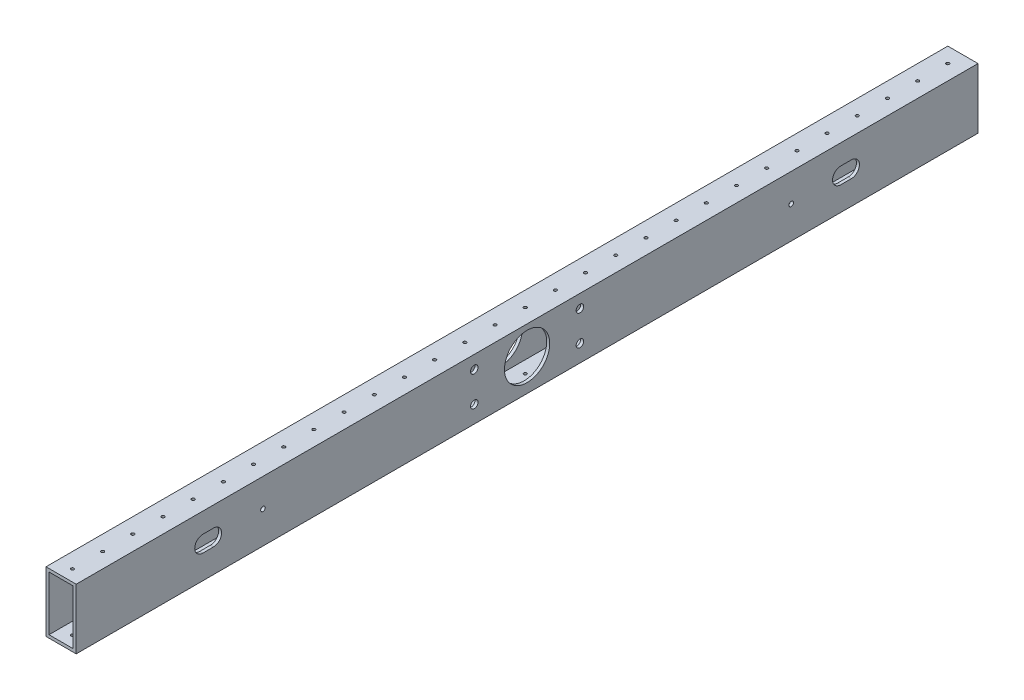
from build123d import *

# Parameters (mm, degrees)
SKETCH1_W           = 25.4
SKETCH1_H           = 50.8
SKETCH1_W_2         = 20.32
SKETCH1_H_2         = 45.72
EXTRUDE_THIN1_DEPTH = 379.4125
SKETCH2_R           = 1.27
CUT_EXTRUDE1_DEPTH  = 384.008844749
LPATTERN1_COUNT     = 30
LPATTERN1_PITCH     = 25.4
SKETCH4_R           = 19.05
SKETCH4_R_2         = 1.9304
CUT_EXTRUDE2_DEPTH  = 382.109124997
SKETCH5_R           = 3.175
CUT_EXTRUDE3_DEPTH  = 382.109124997


with BuildPart() as part:
    # Sketch1 → Extrude-Thin1 (new, symmetric)
    with BuildSketch(Plane.XY):
        Rectangle(SKETCH1_W, SKETCH1_H)
        Rectangle(SKETCH1_W_2, SKETCH1_H_2, mode=Mode.SUBTRACT)
    extrude(amount=EXTRUDE_THIN1_DEPTH, both=True)

    # Sketch2 → Cut-Extrude1 (cut, through all)
    with BuildSketch(Plane(origin=(0, 25.4, 0), x_dir=(1, 0, 0), z_dir=(0, 1, 0))):
        with Locations(Location((0, 366.7125, 0), (0, 0, 270))):
            Circle(SKETCH2_R)
    cut_extrude1 = extrude(amount=-CUT_EXTRUDE1_DEPTH, mode=Mode.SUBTRACT)

    # LPattern1: Cut-Extrude1 ×30
    with Locations(*[(0, 0, i * LPATTERN1_PITCH) for i in range(1, LPATTERN1_COUNT)]):
        add(cut_extrude1, mode=Mode.SUBTRACT)

    # Sketch4 → Cut-Extrude2 (cut, through all)
    with BuildSketch(Plane.ZY.offset(12.7)):
        with Locations((0, 1.651)):
            Circle(SKETCH4_R)
        with Locations((-222.25, 1.651)):
            Circle(SKETCH4_R_2)
        with Locations((222.25, 1.651)):
            Circle(SKETCH4_R_2)
        with BuildLine():
            Line((263.906, 8.509), (272.796, 8.509))
            ThreePointArc((272.796, 8.509), (279.654, 1.651), (272.796, -5.207))
            Line((272.796, -5.207), (263.906, -5.207))
            ThreePointArc((263.906, -5.207), (257.048, 1.651), (263.906, 8.509))
        make_face()
        with BuildLine():
            Line((-263.906, 8.509), (-272.796, 8.509))
            ThreePointArc((-272.796, 8.509), (-279.654, 1.651), (-272.796, -5.207))
            Line((-272.796, -5.207), (-263.906, -5.207))
            ThreePointArc((-263.906, -5.207), (-257.048, 1.651), (-263.906, 8.509))
        make_face()
    extrude(amount=-CUT_EXTRUDE2_DEPTH, mode=Mode.SUBTRACT)

    # Sketch5 → Cut-Extrude3 (cut, through all)
    with BuildSketch(Plane.ZY.offset(12.7)):
        with Locations((-44.45, 14.351)):
            Circle(SKETCH5_R)
        with Locations((-44.45, -11.049)):
            Circle(SKETCH5_R)
        with Locations((44.45, 14.351)):
            Circle(SKETCH5_R)
        with Locations((44.45, -11.049)):
            Circle(SKETCH5_R)
    extrude(amount=-CUT_EXTRUDE3_DEPTH, mode=Mode.SUBTRACT)


solid = part.part
